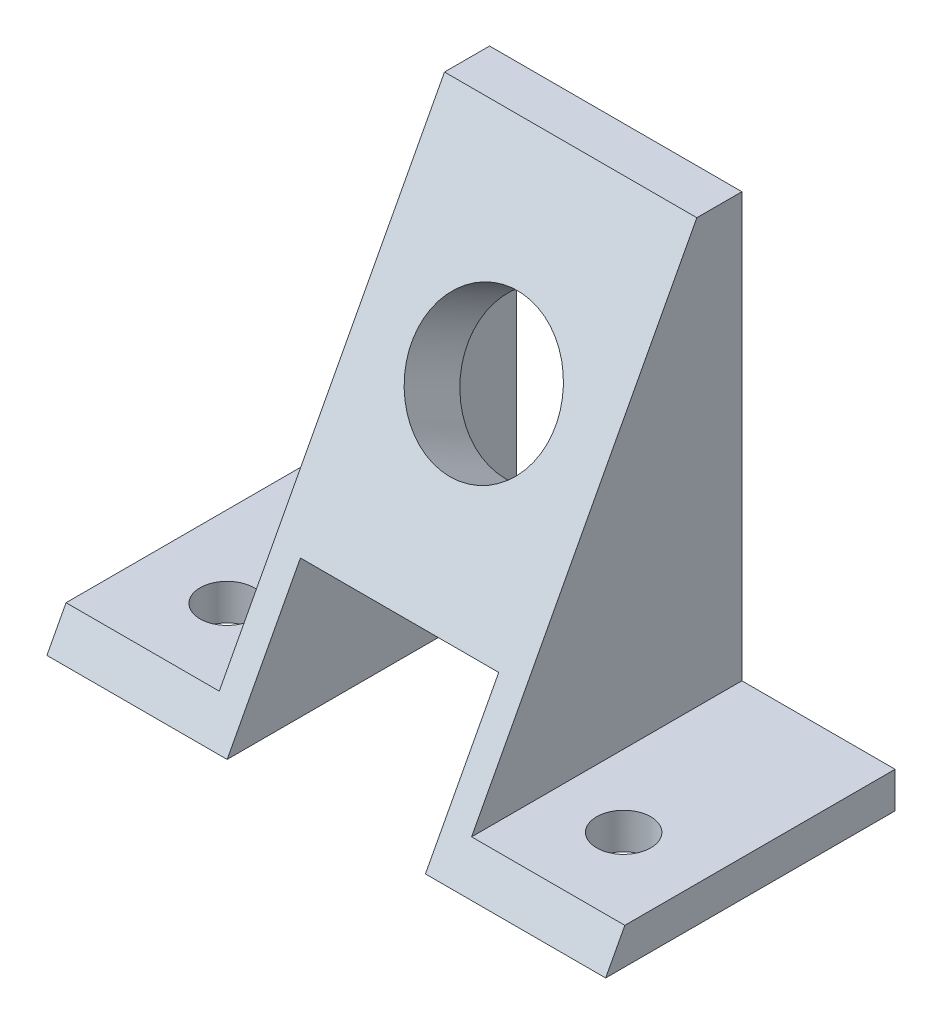
from build123d import *

# Parameters (mm, degrees)
BOSS_EXTRUDE1_DEPTH     = 14
SKETCH4_W               = 28
SKETCH4_H               = 51
BOSS_EXTRUDE2_DEPTH     = 5
SKETCH3_R               = 8
CUT_EXTRUDE1_DEPTH      = 50.099012473
CUT_EXTRUDE3_DEPTH      = 11
CUT_EXTRUDE4_DEPTH      = 49.798206602
CUT_EXTRUDE4_DEPTH_BACK = 49.798206602
SKETCH7_W               = 22
SKETCH7_H               = 15.296617448
BOSS_EXTRUDE3_DEPTH     = 17
CUT_EXTRUDE5_DEPTH      = 63.42802941
CUT_EXTRUDE5_DEPTH_BACK = 63.42802941
SKETCH11_R              = 3


with BuildPart() as part:
    # Sketch1 → Boss-Extrude1 (new, symmetric)
    with BuildSketch(Plane(origin=(0, 0, 0), x_dir=(0, 0, -1), z_dir=(1, 0, 0))):
        Polygon((-13.807105756, -7.671099373), (13.310075259, 43.328900627), (13.310075259, -7.671099373), align=None)
    extrude(amount=BOSS_EXTRUDE1_DEPTH, both=True)

    # Sketch4 → Boss-Extrude2 (add)
    with BuildSketch(Plane(origin=(0, 0, -13.310075259), x_dir=(-1, 0, 0), z_dir=(0, 0, -1))):
        with Locations((0, 17.828900627)):
            Rectangle(SKETCH4_W, SKETCH4_H)
    extrude(amount=BOSS_EXTRUDE2_DEPTH)

    # Sketch3 → Cut-Extrude1 (cut, through all)
    with BuildSketch(Plane(origin=(0, 4.032567199, 7.584155854), x_dir=(1, 0, 0), z_dir=(0, 0.46947156278589475, 0.8829475928589249))):
        with Locations(Location((0, 23.97057959, 0), (0, 0, 270))):
            Circle(SKETCH3_R)
    extrude(amount=-CUT_EXTRUDE1_DEPTH, mode=Mode.SUBTRACT)

    # Sketch6 → Cut-Extrude3 (cut, symmetric)
    with BuildSketch(Plane(origin=(0, 0, 0), x_dir=(0, 0, -1), z_dir=(1, 0, 0))):
        Polygon((18.310075259, 37.822151676), (0.763812466, 4.822430874), (0.763812466, -14.665024569), (18.310075259, -14.665024569), (18.310075259, 4.822430874), align=None)
    extrude(amount=CUT_EXTRUDE3_DEPTH, both=True, mode=Mode.SUBTRACT)

    # Sketch7 → Cut-Extrude4 (cut, two sides: drawn at the far end of the back side and taken through both)
    with BuildSketch(Plane(origin=(0, 0, -0.763812466), x_dir=(-1, 0, 0), z_dir=(0, 0, -1)).offset(-CUT_EXTRUDE4_DEPTH_BACK)):
        with Locations((0, -0.022790649)):
            Rectangle(SKETCH7_W, SKETCH7_H)
    extrude(amount=CUT_EXTRUDE4_DEPTH + CUT_EXTRUDE4_DEPTH_BACK, mode=Mode.SUBTRACT)

    # Sketch10 → Boss-Extrude3 (add)
    with BuildSketch(Plane(origin=(14, 0, 0), x_dir=(0, 0, -1), z_dir=(1, 0, 0))):
        Polygon((-13.807105756, -7.671099373), (-11.680268029, -3.671099373), (18.310075259, -3.671099373), (18.310075259, -7.671099373), align=None)
    boss_extrude3 = extrude(amount=BOSS_EXTRUDE3_DEPTH)

    # Mirror5: Boss-Extrude3 across plane
    add(boss_extrude3.mirror(Plane(origin=(0, 0, 0), x_dir=(0, 0, 1), z_dir=(1, 0, 0))))

    # Sketch11 → Cut-Extrude5 (cut, two sides: drawn at the far end of the back side and taken through both)
    with BuildSketch(Plane.XZ.offset(7.671099373).offset(-CUT_EXTRUDE5_DEPTH_BACK)):
        with Locations(Location((22, 2.807105756, 0), (0, 0, 270))):
            Circle(SKETCH11_R)
        with Locations(Location((-22, 2.807105756, 0), (0, 0, 90))):
            Circle(SKETCH11_R)
    extrude(amount=CUT_EXTRUDE5_DEPTH + CUT_EXTRUDE5_DEPTH_BACK, mode=Mode.SUBTRACT)


solid = part.part
